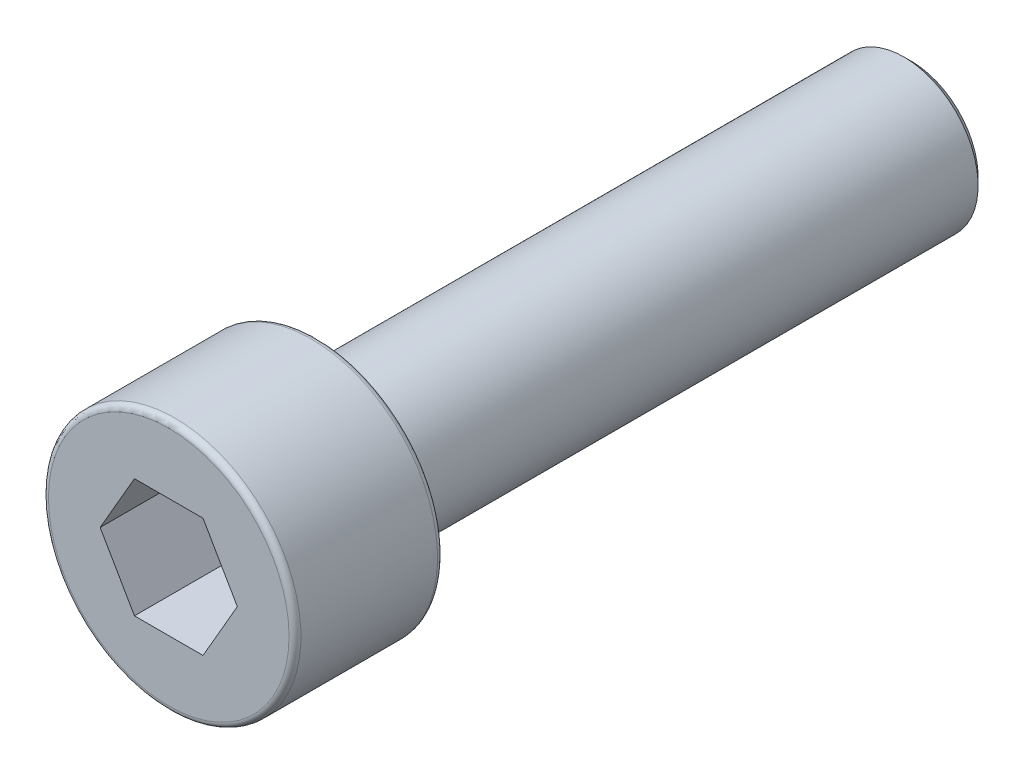
from build123d import *

# Parameters (mm, degrees)
SKETCH1_R           = 4.25
BOSS_EXTRUDE1_DEPTH = 5
SKETCH2_R           = 2.5
BOSS_EXTRUDE2_DEPTH = 20
CUT_EXTRUDE1_DEPTH  = 4
CHAMFER1_SIZE       = 0.25
FILLET1_R           = 0.2


with BuildPart() as part:
    # Sketch1 → Boss-Extrude1 (new body)
    with BuildSketch(Plane.XY.offset(25)):
        Circle(SKETCH1_R)
    extrude(amount=-BOSS_EXTRUDE1_DEPTH)

    # Sketch2 → Boss-Extrude2 (add)
    with BuildSketch(Plane(origin=(0, 0, 20), x_dir=(-1, 0, 0), z_dir=(0, 0, -1))):
        Circle(SKETCH2_R)
    extrude(amount=BOSS_EXTRUDE2_DEPTH)

    # Sketch3 → Cut-Extrude1 (cut)
    with BuildSketch(Plane.XY.offset(25)):
        Polygon((-2.309401077, 0), (-1.154700538, -2), (1.154700538, -2), (2.309401077, 0), (1.154700538, 2), (-1.154700538, 2), align=None)
    extrude(amount=-CUT_EXTRUDE1_DEPTH, mode=Mode.SUBTRACT)

    # Chamfer1
    chamfer1_edges = [part.edges().sort_by_distance(p)[0] for p in [
        (2.5, 0, 0),
    ]]
    chamfer(chamfer1_edges, length=CHAMFER1_SIZE)

    # Fillet1
    fillet1_edges = [part.edges().sort_by_distance(p)[0] for p in [
        (-4.25, 0, 20),
        (-4.25, 0, 25),
    ]]
    fillet(fillet1_edges, radius=FILLET1_R)


solid = part.part
